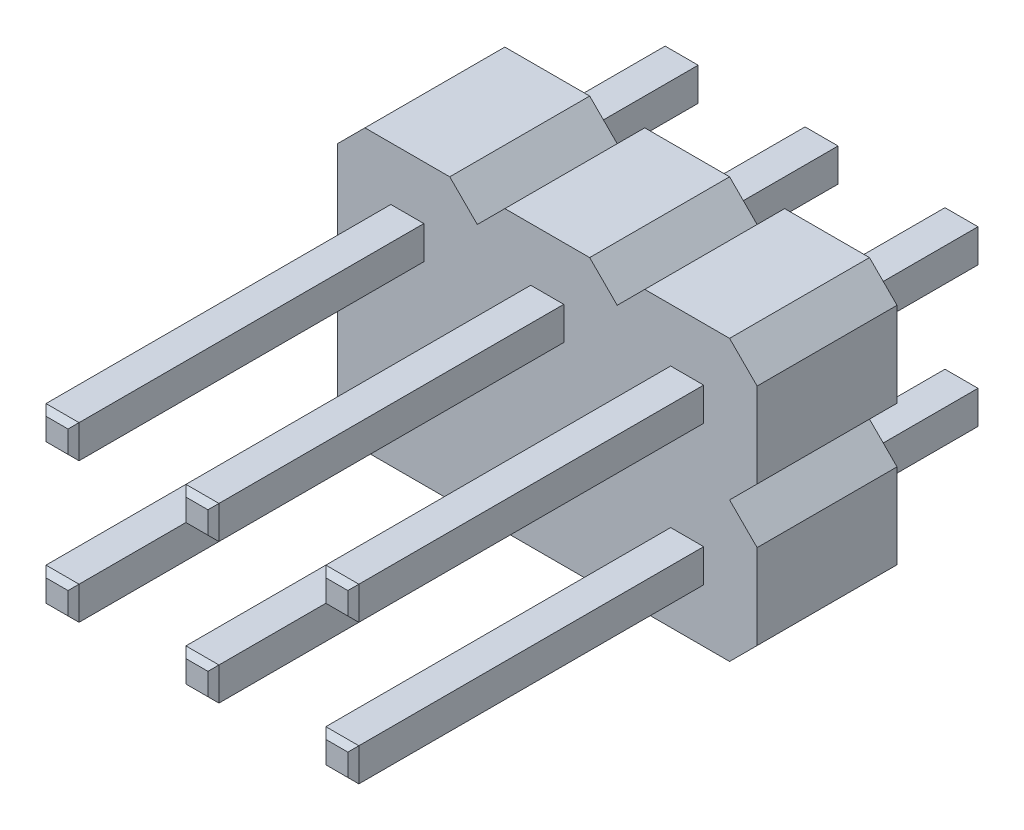
from build123d import *

# Parameters (mm, degrees)
PLASTIC_DEPTH                     = 2.54
SKETCH2_W                         = 11.44
SKETCH2_H                         = 0.6
CONTACT_DEPTH                     = 0.3
CHAMFER1_SIZE                     = 0.1
PATTERN_LINEAR_1_COUNT            = 3
PATTERN_LINEAR_1_PITCH            = 2.54
PATTERN_LINEAR_1_COUNT_DIR2       = 2
PATTERN_LINEAR_1_PITCH_DIR2       = 2.54
CHAMFER1_OF_PATTERN_LINEAR_1_SIZE = 0.1


with BuildPart() as part:
    # Sketch1 → Plastic (new body)
    with BuildSketch(Plane.XY):
        Polygon((-0.77, 1.27), (0.77, 1.27), (1.27, 0.77), (1.27, -0.77), (0.77, -1.27), (-0.77, -1.27), (-1.27, -0.77), (-1.27, 0.77), align=None)
    plastic = extrude(amount=PLASTIC_DEPTH)

    # Sketch2 → Contact (add, symmetric)
    with BuildSketch(Plane(origin=(0, 0, 0), x_dir=(0, 0, -1), z_dir=(1, 0, 0))):
        with Locations((-3.18, 0)):
            Rectangle(SKETCH2_W, SKETCH2_H)
    contact = extrude(amount=CONTACT_DEPTH, both=True)

    # Chamfer1
    chamfer1_edges = [part.edges().sort_by_distance(p)[0] for p in [
        (0, -0.3, 8.9),
        (0.3, 0, 8.9),
        (-0.3, 0, -2.54),
        (0, -0.3, -2.54),
        (0, 0.3, -2.54),
        (-0.3, 0, 8.9),
        (0, 0.3, 8.9),
        (0.3, 0, -2.54),
    ]]
    chamfer(chamfer1_edges, length=CHAMFER1_SIZE)

    # Линейный массив1: Plastic, Contact 3 × 2
    with Locations(*[(i * PATTERN_LINEAR_1_PITCH, j * PATTERN_LINEAR_1_PITCH_DIR2, 0) for i in range(PATTERN_LINEAR_1_COUNT) for j in range(PATTERN_LINEAR_1_COUNT_DIR2) if (i, j) != (0, 0)]):
        add(plastic)
        add(contact)

    # Chamfer1 of Линейный массив1
    chamfer1_of_pattern_linear_1_edges = [part.edges().sort_by_distance(p)[0] for p in [
        (0, 2.24, 8.9),
        (0.3, 2.54, 8.9),
        (-0.3, 2.54, -2.54),
        (0, 2.24, -2.54),
        (0, 2.84, -2.54),
        (-0.3, 2.54, 8.9),
        (0, 2.84, 8.9),
        (0.3, 2.54, -2.54),
        (2.54, -0.3, 8.9),
        (2.84, 0, 8.9),
        (2.24, 0, -2.54),
        (2.54, -0.3, -2.54),
        (2.54, 0.3, -2.54),
        (2.24, 0, 8.9),
        (2.54, 0.3, 8.9),
        (2.84, 0, -2.54),
        (2.54, 2.24, 8.9),
        (2.84, 2.54, 8.9),
        (2.24, 2.54, -2.54),
        (2.54, 2.24, -2.54),
        (2.54, 2.84, -2.54),
        (2.24, 2.54, 8.9),
        (2.54, 2.84, 8.9),
        (2.84, 2.54, -2.54),
        (5.08, -0.3, 8.9),
        (5.38, 0, 8.9),
        (4.78, 0, -2.54),
        (5.08, -0.3, -2.54),
        (5.08, 0.3, -2.54),
        (4.78, 0, 8.9),
        (5.08, 0.3, 8.9),
        (5.38, 0, -2.54),
        (5.08, 2.24, 8.9),
        (5.38, 2.54, 8.9),
        (4.78, 2.54, -2.54),
        (5.08, 2.24, -2.54),
        (5.08, 2.84, -2.54),
        (4.78, 2.54, 8.9),
        (5.08, 2.84, 8.9),
        (5.38, 2.54, -2.54),
    ]]
    chamfer(chamfer1_of_pattern_linear_1_edges, length=CHAMFER1_OF_PATTERN_LINEAR_1_SIZE)


solid = part.part
